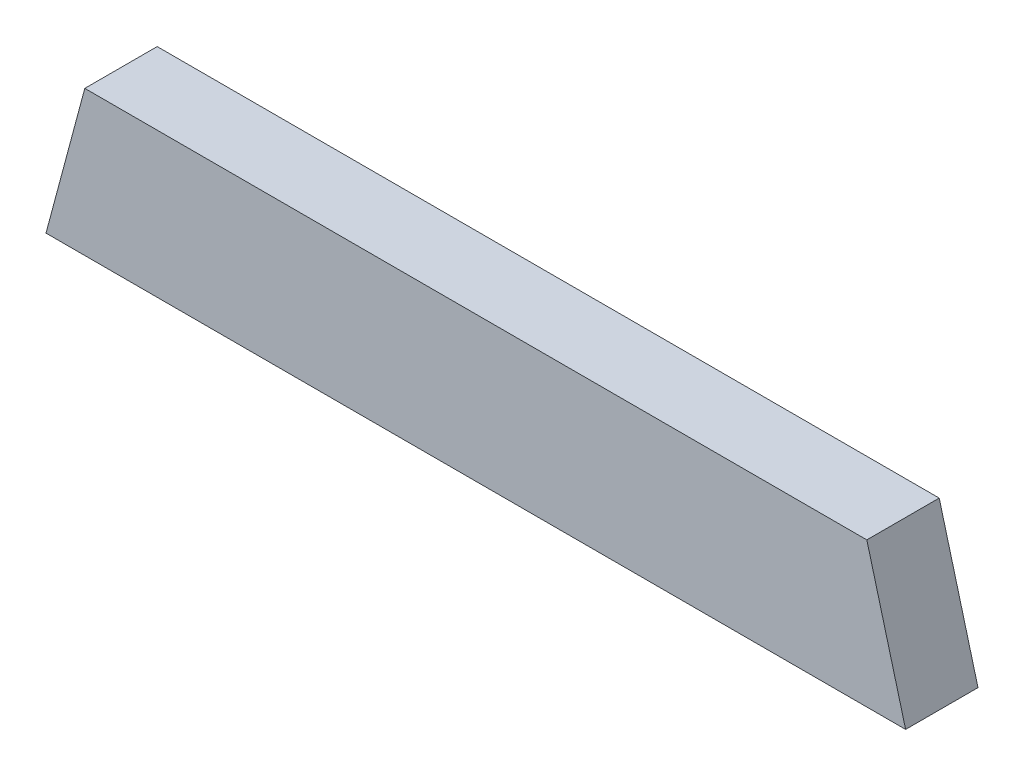
from build123d import *

# Parameters (mm, degrees)
BOSS_EXTRUDE1_DEPTH = 50.8


with BuildPart() as part:
    # Sketch1 → Boss-Extrude1 (new body)
    with BuildSketch(Plane.XY):
        Polygon((27.223637951, 101.6), (0, 0), (603.25, 0), (576.026362049, 101.6), align=None)
    extrude(amount=BOSS_EXTRUDE1_DEPTH)


solid = part.part
